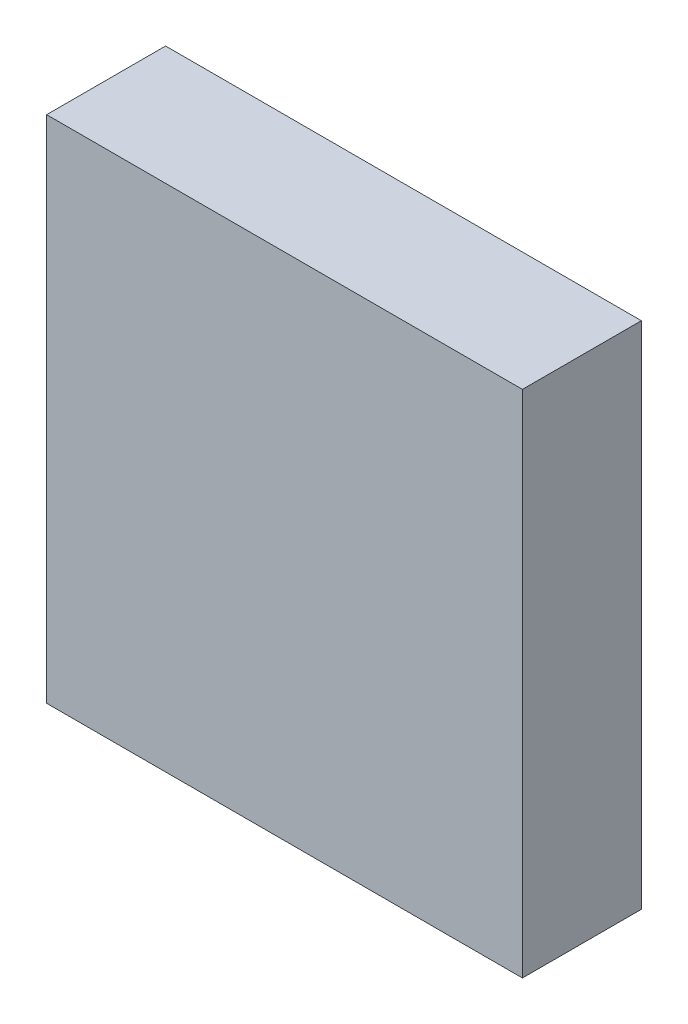
from build123d import *

# Parameters (mm, degrees)
ESQUISSE1_W                   = 140
ESQUISSE1_H                   = 150
BOITIER_ALIMENTATION_5V_DEPTH = 35
BORNIER_PUISSANCE_START       = 4
ESQUISSE2_W                   = 90
ESQUISSE2_H                   = 6
BORNIER_PUISSANCE_DEPTH       = 16


with BuildPart() as part:
    # Esquisse1 → Boitier_alimentation_5V (new body)
    with BuildSketch(Plane.XY):
        Rectangle(ESQUISSE1_W, ESQUISSE1_H)
    extrude(amount=BOITIER_ALIMENTATION_5V_DEPTH)

    # Esquisse2 → Bornier_puissance (add)
    with BuildSketch(Plane.XY.offset(BORNIER_PUISSANCE_START)):
        with Locations((0, -78)):
            Rectangle(ESQUISSE2_W, ESQUISSE2_H)
    extrude(amount=BORNIER_PUISSANCE_DEPTH)


solid = part.part
